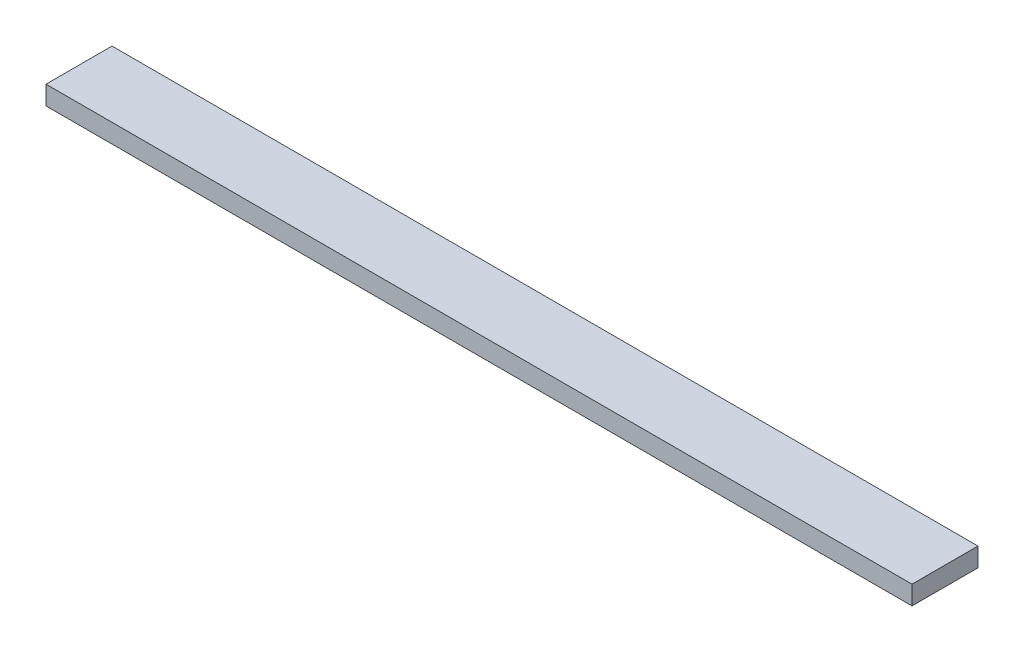
from build123d import *

# Parameters (mm, degrees)
SKETCH1_W           = 183.666666702
SKETCH1_H           = 14
BOSS_EXTRUDE1_DEPTH = 4


with BuildPart() as part:
    # Sketch1 → Boss-Extrude1 (new body)
    with BuildSketch(Plane(origin=(0, 0, 0), x_dir=(1, 0, 0), z_dir=(0, 1, 0))):
        Rectangle(SKETCH1_W, SKETCH1_H)
    extrude(amount=BOSS_EXTRUDE1_DEPTH)


solid = part.part
